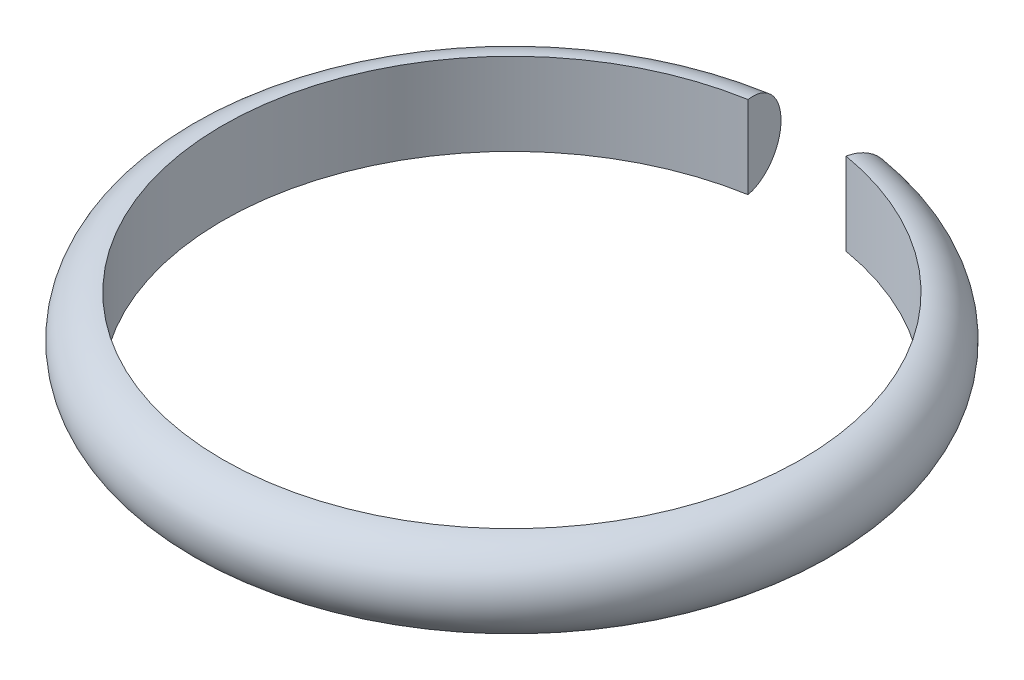
from build123d import *

# Parameters (mm, degrees)
BALAYAGE1_PROFILE_R          = 5
ENL_V_MAT_EXTRU_1_DEPTH      = 57.789083608
ENL_V_MAT_EXTRU_1_DEPTH_BACK = 57.789083608
ESQUISSE10_R                 = 35.1


with BuildPart() as part:
    # Balayage1: sweep along a path in Esquisse1
    with BuildLine(Plane(origin=(0, 0, 0), x_dir=(1, 0, 0), z_dir=(0, 1, 0))) as balayage1_path:
        ThreePointArc((-5.927042228, 34.494494784), (0, -35), (5.927042228, 34.494494784))
    # Balayage1 profile (on start of the path) → Balayage1 (sweep)
    with BuildSketch(Plane(origin=(-5.927042228, 0, -34.494494784), x_dir=(-0.1693440636674477, 0, -0.9855569938367824), z_dir=(-0.9855569938367824, 0, 0.1693440636674477))):
        Circle(BALAYAGE1_PROFILE_R)
    sweep(path=balayage1_path.line)

    # Esquisse10 → Enlèv. mat.-Extru.1 (cut, two sides: drawn at the far end of the back side and taken through both)
    with BuildSketch(Plane(origin=(0, 0, 0), x_dir=(1, 0, 0), z_dir=(0, 1, 0)).offset(-ENL_V_MAT_EXTRU_1_DEPTH_BACK)):
        Circle(ESQUISSE10_R)
    extrude(amount=ENL_V_MAT_EXTRU_1_DEPTH + ENL_V_MAT_EXTRU_1_DEPTH_BACK, mode=Mode.SUBTRACT)


solid = part.part
